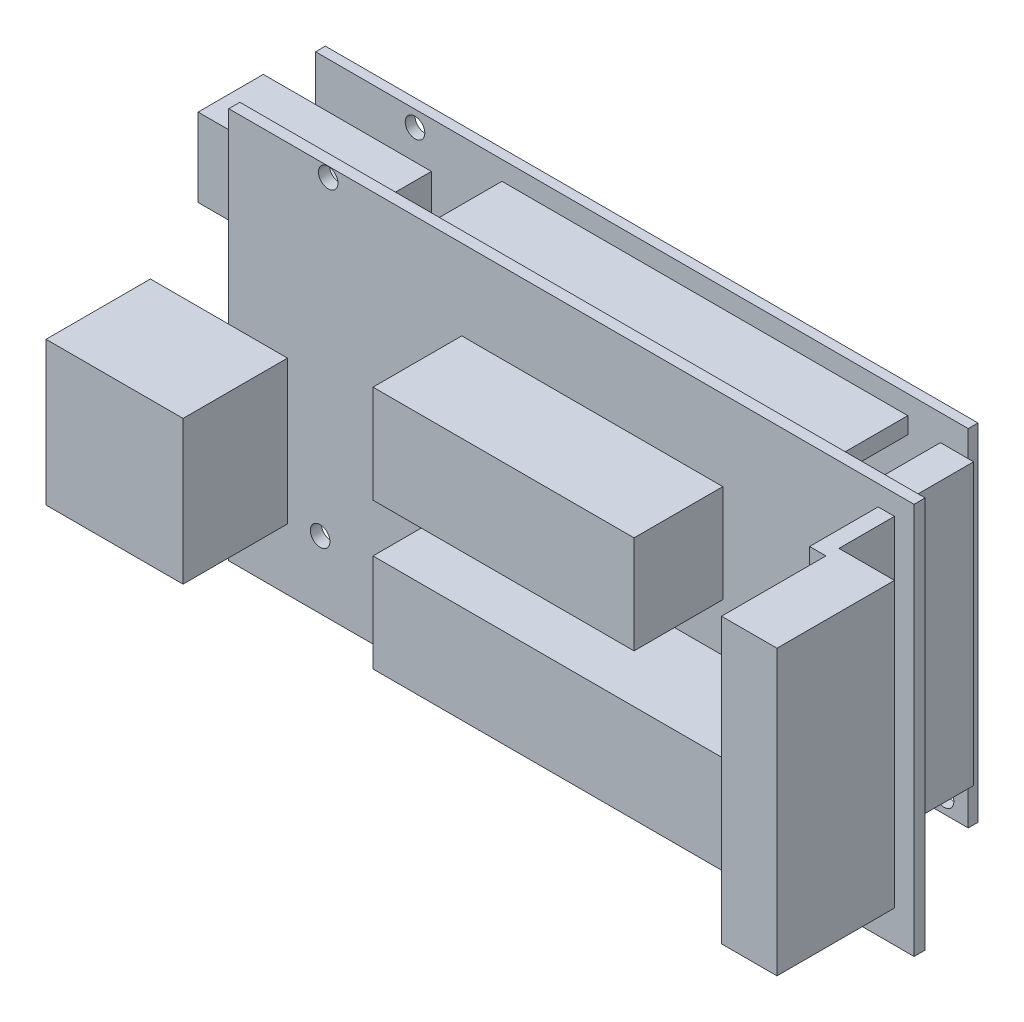
from build123d import *

# Parameters (mm, degrees)
ESBO_O1_W                 = 105
ESBO_O1_H                 = 60
RESSALTO_EXTRUS_O1_DEPTH  = 1.7
ESBO_O2_W                 = 60
ESBO_O2_H                 = 15
ESBO_O2_W_2               = 40
RESSALTO_EXTRUS_O2_DEPTH  = 13.6
RESSALTO_EXTRUS_O6_START  = 11.6
ESBO_O3_W                 = 100
ESBO_O3_H                 = 53
RESSALTO_EXTRUS_O6_DEPTH  = 1.5
ESBO_O4_W                 = 62.184169383
ESBO_O4_H                 = 2.54
ESBO_O4_W_2               = 5.08
ESBO_O4_H_2               = 42.957805244
ESBO_O4_W_3               = 56.07185462
RESSALTO_EXTRUS_O8_DEPTH  = 11.6
ESBO_O6_W                 = 21
ESBO_O6_H                 = 22
RESSALTO_EXTRUS_O9_DEPTH  = 16
ESBO_O7_W                 = 25.746964405
ESBO_O7_H                 = 12
RESSALTO_EXTRUS_O10_DEPTH = 10
ESBO_O8_R                 = 1.5
CORTE_EXTRUS_O1_DEPTH     = 78.869763066
RESSALTO_EXTRUS_O11_DEPTH = 56.905179102
CORTE_EXTRUS_O2_REACH     = 131.446


with BuildPart() as part:
    # Esboço1 → Ressalto-extrusão1 (new body)
    with BuildSketch(Plane.XY):
        Rectangle(ESBO_O1_W, ESBO_O1_H)
    extrude(amount=RESSALTO_EXTRUS_O1_DEPTH)

    # Esboço2 → Ressalto-extrusão2 (add)
    with BuildSketch(Plane.XY.offset(1.7)):
        with Locations((13.2, -12.2)):
            Rectangle(ESBO_O2_W, ESBO_O2_H)
        with Locations((3.2, 10.2)):
            Rectangle(ESBO_O2_W_2, ESBO_O2_H)
    extrude(amount=RESSALTO_EXTRUS_O2_DEPTH)



with BuildPart() as body_2:
    # Esboço3 → Ressalto-extrusão6 (new body)
    with BuildSketch(Plane(origin=(0, 0, 0), x_dir=(-1, 0, 0), z_dir=(0, 0, -1)).offset(RESSALTO_EXTRUS_O6_START)):
        with Locations((2.5, 4.4)):
            Rectangle(ESBO_O3_W, ESBO_O3_H)
    extrude(amount=RESSALTO_EXTRUS_O6_DEPTH)


with BuildPart() as part_1:
    add(part.part)

    add(body_2.part)  # Ressalto-extrusão8 merges body 2
    # Esboço4 → Ressalto-extrusão8 (add)
    with BuildSketch(Plane.XY.offset(-11.6)):
        with Locations((7.150543675, 26.719832293)):
            Rectangle(ESBO_O4_W, ESBO_O4_H)
        with Locations((45.784919315, 5.42627648)):
            Rectangle(ESBO_O4_W_2, ESBO_O4_H_2)
        with Locations((10.206701056, -18.689881399)):
            Rectangle(ESBO_O4_W_3, ESBO_O4_H)
    extrude(amount=RESSALTO_EXTRUS_O8_DEPTH)

    # Esboço6 → Ressalto-extrusão9 (add)
    with BuildSketch(Plane.XY.offset(1.7)):
        with Locations((-54, -9.6)):
            Rectangle(ESBO_O6_W, ESBO_O6_H)
    extrude(amount=RESSALTO_EXTRUS_O9_DEPTH)

    # Esboço7 → Ressalto-extrusão10 (add)
    with BuildSketch(Plane.XY.offset(-11.6)):
        with Locations((-47.626517798, 17.9)):
            Rectangle(ESBO_O7_W, ESBO_O7_H)
    extrude(amount=RESSALTO_EXTRUS_O10_DEPTH)

    # Esboço8 → Corte-extrusão1 (cut, through all)
    with BuildSketch(Plane(origin=(0, 0, -13.1), x_dir=(-1, 0, 0), z_dir=(0, 0, -1))):
        with Locations((37.26, 28.47)):
            Circle(ESBO_O8_R)
        with Locations((38.5, -19.7)):
            Circle(ESBO_O8_R)
        with Locations((-43.8, -19.7)):
            Circle(ESBO_O8_R)
    extrude(amount=-CORTE_EXTRUS_O1_DEPTH, mode=Mode.SUBTRACT)

    # Esboço9 → Ressalto-extrusão11 (add)
    with BuildSketch(Plane.XZ.offset(30)):
        Polygon((49.5, 1.7), (49.5, 10.2), (58, 10.2), (58, 28.2), (49.5, 28.2), (49.5, 12.2), (47, 12.2), (47, 1.7), align=None)
    extrude(amount=-RESSALTO_EXTRUS_O11_DEPTH)

    # Corte-extrusão2: up to this face of the body (flat: up to its plane)
    corte_extrus_o2_end = Plane(part_1.part.faces().sort_by_distance((47, -1.547410449, 6.95))[0])
    # Esboço10 → Corte-extrusão2 (cut, up to the picked face)
    with BuildSketch(Plane(origin=(58, 0, 0), x_dir=(0, 0, -1), z_dir=(1, 0, 0)), mode=Mode.PRIVATE) as corte_extrus_o2_sk1:
        Polygon((-10.2, -16.57372352), (-28.2, -16.57372352), (-28.2, -30), (-1.7, -30), (-1.7, -16.57372352), align=None)
    corte_extrus_o2_tool1 = split(extrude(corte_extrus_o2_sk1.sketch, amount=-CORTE_EXTRUS_O2_REACH, mode=Mode.PRIVATE), bisect_by=corte_extrus_o2_end, keep=Keep.BOTH, mode=Mode.PRIVATE)
    add(corte_extrus_o2_tool1.solids().sort_by(Axis((58, -23.286862, 14.95), (-1, 0, 0)))[0], mode=Mode.SUBTRACT)


solid = part_1.part
